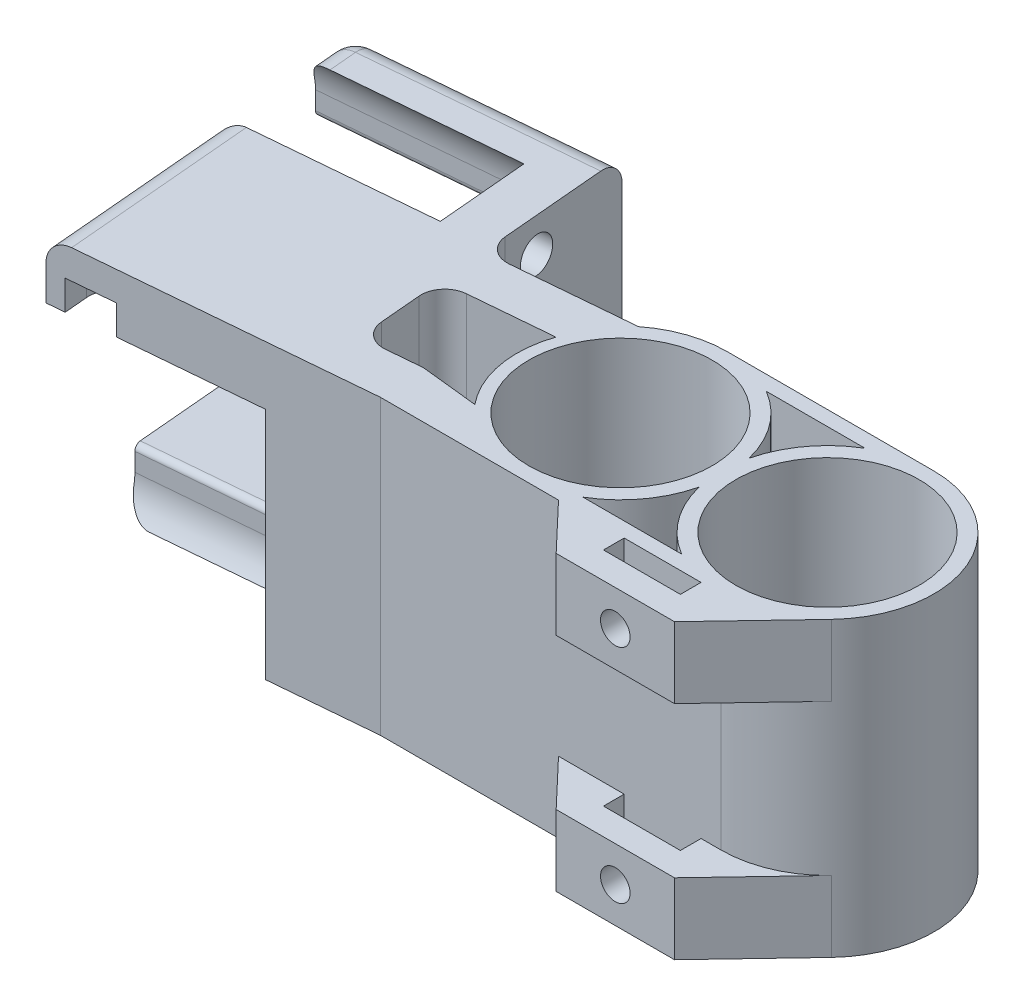
from build123d import *

# Parameters (mm, degrees)
SKETCH1_R               = 7.75
BOSS_EXTRUDE1_DEPTH     = 24
BOSS_EXTRUDE2_START     = 0.75
SKETCH2_R               = 4.33
BOSS_EXTRUDE2_DEPTH     = 0.75
SKETCH4_W               = 10
SKETCH4_H               = 6
BOSS_EXTRUDE4_DEPTH     = 4
CUT_EXTRUDE1_DEPTH      = 35.968736037
CUT_EXTRUDE1_DEPTH_BACK = 35.968736037
SKETCH5_W               = 6.5
SKETCH5_H               = 1.75
SKETCH6_R               = 1.25
CUT_EXTRUDE2_DEPTH      = 16
BOSS_EXTRUDE5_START     = -24.75
BOSS_EXTRUDE5_DEPTH     = 24.75
CUT_EXTRUDE3_DEPTH      = 39.520286863
SKETCH9_W               = 12.886425037
SKETCH9_H               = 24.75
BOSS_EXTRUDE6_DEPTH     = 4
FILLET1_R               = 2
FILLET2_R               = 2
BOSS_EXTRUDE9_DEPTH     = 17.13
SKETCH14_R              = 1.5
CUT_EXTRUDE5_DEPTH      = 6
BOSS_EXTRUDE10_DEPTH    = 14.84
FILLET4_R               = 2
SKETCH16_W              = 4
SKETCH16_H              = 2.5
CUT_EXTRUDE6_DEPTH      = 4
FILLET5_R               = 2
BOSS_EXTRUDE11_DEPTH    = 6
BOSS_EXTRUDE12_START    = -6
BOSS_EXTRUDE12_DEPTH    = 6


with BuildPart() as part:
    # Sketch1 → Boss-Extrude1 (new body)
    with BuildSketch(Plane(origin=(0, 0, 0), x_dir=(1, 0, 0), z_dir=(0, 1, 0))):
        with BuildLine():
            Line((0, -9), (17.5, -9))
            ThreePointArc((17.5, -9), (26.5, 0), (17.5, 9))
            Line((17.5, 9), (0, 9))
            ThreePointArc((0, 9), (-9, 0), (0, -9))
        make_face()
        with Locations(Location((17.5, 0, 0), (0, 0, 270))):
            Circle(SKETCH1_R, mode=Mode.SUBTRACT)
        with BuildLine():
            ThreePointArc((8.75, -2.106537443), (10.26424991, -5.352001554), (12.924248696, -7.75))
            Line((12.924248696, -7.75), (4.575751304, -7.75))
            ThreePointArc((4.575751304, -7.75), (7.23575009, -5.352001554), (8.75, -2.106537443))
        make_face(mode=Mode.SUBTRACT)
        with Locations(Location((0, 0, 0), (0, 0, 270))):
            Circle(SKETCH1_R, mode=Mode.SUBTRACT)
        with BuildLine():
            Line((4.575751304, 7.75), (12.924248696, 7.75))
            ThreePointArc((12.924248696, 7.75), (10.26424991, 5.352001554), (8.75, 2.106537443))
            ThreePointArc((8.75, 2.106537443), (7.23575009, 5.352001554), (4.575751304, 7.75))
        make_face(mode=Mode.SUBTRACT)
    extrude(amount=BOSS_EXTRUDE1_DEPTH)

    # Sketch2 → Boss-Extrude2 (add)
    with BuildSketch(Plane.XZ.offset(BOSS_EXTRUDE2_START)):
        with BuildLine():
            Line((17.5, 9), (0, 9))
            ThreePointArc((0, 9), (-9, 0), (0, -9))
            Line((0, -9), (17.5, -9))
            ThreePointArc((17.5, -9), (26.5, 0), (17.5, 9))
        make_face()
        with Locations(Location((17.5, 0, 0), (0, 0, 270))):
            Circle(SKETCH2_R, mode=Mode.SUBTRACT)
        with Locations(Location((0, 0, 0), (0, 0, 270))):
            Circle(SKETCH2_R, mode=Mode.SUBTRACT)
    extrude(amount=-BOSS_EXTRUDE2_DEPTH)

    # Sketch4 → Boss-Extrude4 (add)
    with BuildSketch(Plane.XY.offset(9)):
        with Locations((12.5625, 2.25)):
            Rectangle(SKETCH4_W, SKETCH4_H)
        with Locations((12.5625, 21)):
            Rectangle(SKETCH4_W, SKETCH4_H)
    extrude(amount=BOSS_EXTRUDE4_DEPTH)

    # Sketch5 → Cut-Extrude1 (cut, two sides: drawn at the far end of the back side and taken through both)
    with BuildSketch(Plane.XZ.offset(-18).offset(-CUT_EXTRUDE1_DEPTH_BACK)):
        with Locations((12.5625, 9.875)):
            Rectangle(SKETCH5_W, SKETCH5_H)
    extrude(amount=CUT_EXTRUDE1_DEPTH + CUT_EXTRUDE1_DEPTH_BACK, mode=Mode.SUBTRACT)

    # Sketch6 → Cut-Extrude2 (cut)
    with BuildSketch(Plane.XY.offset(13)):
        with Locations((12.5625, 2.25)):
            Circle(SKETCH6_R)
        with Locations((12.5625, 21)):
            Circle(SKETCH6_R)
    extrude(amount=-CUT_EXTRUDE2_DEPTH, mode=Mode.SUBTRACT)

    # Sketch7 → Boss-Extrude5 (add)
    with BuildSketch(Plane(origin=(0, 24, 0), x_dir=(1, 0, 0), z_dir=(0, 1, 0)).offset(BOSS_EXTRUDE5_START)):
        with BuildLine():
            Line((-20.224515403, -9.780709308), (-11.300967177, -9))
            Line((-11.300967177, -9), (0, -9))
            ThreePointArc((0, -9), (-8.505937794, -2.940922006), (-5.558955476, 7.077995056))
            Line((-5.558955476, 7.077995056), (-21.576855644, 5.676610378))
            Line((-21.576855644, 5.676610378), (-20.224515403, -9.780709308))
        make_face()
    extrude(amount=BOSS_EXTRUDE5_DEPTH)

    # Sketch8 → Cut-Extrude3 (cut, through all)
    with BuildSketch(Plane(origin=(0, 24, 0), x_dir=(1, 0, 0), z_dir=(0, 1, 0))):
        with BuildLine():
            Line((-16.588359581, -5.447307545), (-11.649590148, -5.015221208))
            Line((-11.649590148, -5.015221208), (-6.776158873, -5.535898385))
            ThreePointArc((-6.776158873, -5.535898385), (-8.611505528, -1.550636174), (-8.281582293, 2.824516725))
            Line((-8.281582293, 2.824516725), (-17.24345388, 2.040454557))
            Line((-17.24345388, 2.040454557), (-16.588359581, -5.447307545))
        make_face()
    extrude(amount=-CUT_EXTRUDE3_DEPTH, mode=Mode.SUBTRACT)

    # Sketch9 → Boss-Extrude6 (add)
    with BuildSketch(Plane(origin=(-20.92008866, 0, 1.830270598), x_dir=(0.08715574274765853, 0, 0.9961946980917455), z_dir=(-0.9961946980917455, 0, 0.08715574274765853))):
        with Locations((-13.978768561, 11.625)):
            Rectangle(SKETCH9_W, SKETCH9_H)
    extrude(amount=-BOSS_EXTRUDE6_DEPTH)

    # Fillet1
    fillet1_edges = [part.edges().sort_by_distance(p)[0] for p in [
        (-16.588359581, 11.625, 5.447307545),
        (-17.24345388, 11.625, -2.040454557),
        (-17.592076851, 11.625, -6.025233349),
    ]]
    fillet(fillet1_edges, radius=FILLET1_R)

    # Fillet2
    fillet2_edges = [part.edges().sort_by_distance(p)[0] for p in [
        (-20.707592193, -0.75, -18.688310163),
        (-20.707592193, 24, -18.688310163),
    ]]
    fillet(fillet2_edges, radius=FILLET2_R)

    # Sketch13 → Boss-Extrude9 (add)
    with BuildSketch(Plane(origin=(-20.92008866, 0, 1.830270598), x_dir=(0.08715574274765853, 0, 0.9961946980917455), z_dir=(-0.9961946980917455, 0, 0.08715574274765853))):
        with BuildLine():
            Line((-7.231981079, 21.08), (-7.231981079, 19.545))
            ThreePointArc((-7.231981079, 19.545), (-7.085534469, 19.191446609), (-6.731981079, 19.045))
            Line((-6.731981079, 19.045), (7.980808095, 19.045))
            Line((7.980808095, 19.045), (7.980808095, 24))
            Line((7.980808095, 24), (-8.270307829, 24))
            ThreePointArc((-8.270307829, 24), (-7.499287378, 22.629558198), (-7.231981079, 21.08))
        make_face()
        with BuildLine():
            Line((-20.421981079, 19.045), (-17.581981079, 19.045))
            ThreePointArc((-17.581981079, 19.045), (-17.228427688, 19.191446609), (-17.081981079, 19.545))
            Line((-17.081981079, 19.545), (-17.081981079, 21.08))
            ThreePointArc((-17.081981079, 21.08), (-16.814674779, 22.629558198), (-16.043654328, 24))
            Line((-16.043654328, 24), (-18.421981079, 24))
            ThreePointArc((-18.421981079, 24), (-19.836194641, 23.414213562), (-20.421981079, 22))
            Line((-20.421981079, 22), (-20.421981079, 19.045))
        make_face()
        with BuildLine():
            ThreePointArc((-0.281981079, 3.705), (-0.428427688, 4.058553391), (-0.781981079, 4.205))
            Line((-0.781981079, 4.205), (-20.421981079, 4.205))
            Line((-20.421981079, 4.205), (-20.421981079, 1.25))
            ThreePointArc((-20.421981079, 1.25), (-19.836194641, -0.164213562), (-18.421981079, -0.75))
            Line((-18.421981079, -0.75), (0.756345672, -0.75))
            ThreePointArc((0.756345672, -0.75), (-0.014674779, 0.620441802), (-0.281981079, 2.17))
            Line((-0.281981079, 2.17), (-0.281981079, 3.705))
        make_face()
    extrude(amount=BOSS_EXTRUDE9_DEPTH)

    # Sketch14 → Cut-Extrude5 (cut)
    with BuildSketch(Plane(origin=(-20.92008866, 0, 1.830270598), x_dir=(0.08715574274765853, 0, 0.9961946980917455), z_dir=(-0.9961946980917455, 0, 0.08715574274765853))):
        with Locations((-12.456981079, 21.08)):
            Circle(SKETCH14_R)
        with Locations((4.943018921, 2.17)):
            Circle(SKETCH14_R)
    extrude(amount=-CUT_EXTRUDE5_DEPTH, mode=Mode.SUBTRACT)

    # Sketch15 → Boss-Extrude10 (add)
    with BuildSketch(Plane.XZ.offset(-19.045)):
        with BuildLine():
            ThreePointArc((-22.605549661, -17.434636803), (-23.103926759, -18.03259557), (-23.779343463, -18.419566749))
            Line((-23.779343463, -18.419566749), (-22.699981589, -18.513998677))
            Line((-22.699981589, -18.513998677), (-22.605549661, -17.434636803))
        make_face()
    extrude(amount=BOSS_EXTRUDE10_DEPTH)

    # Fillet4
    fillet4_edges = [part.edges().sort_by_distance(p)[0] for p in [
        (-37.99751962, 24, 3.179049421),
        (-38.754734626, -0.75, -5.475957694),
        (-39.713742115, -0.164213562, -16.437463461),
        (-39.764796768, 2.7275, -17.021020804),
        (-39.764796768, 20.5225, -17.021020804),
        (-39.713742115, 23.414213562, -16.437463461),
        (-39.486842865, 24, -13.843993158),
    ]]
    fillet(fillet4_edges, radius=FILLET4_R)

    # Sketch16 → Cut-Extrude6 (cut)
    with BuildSketch(Plane(origin=(0.695573257, 0, 7.95043871), x_dir=(0.9961946980917455, 0, -0.08715574274765835), z_dir=(0.08715574274765836, 0, 0.9961946980917457))):
        with Locations((-34.63, 20.295)):
            Rectangle(SKETCH16_W, SKETCH16_H)
    extrude(amount=-CUT_EXTRUDE6_DEPTH, mode=Mode.SUBTRACT)

    # Fillet5
    fillet5_edges = [part.edges().sort_by_distance(p)[0] for p in [
        (-36.143661505, 20.295, 7.158174775),
        (-34.151272109, 21.545, 6.983863289),
    ]]
    fillet(fillet5_edges, radius=FILLET5_R)

    # Sketch17 → Boss-Extrude11 (add)
    with BuildSketch(Plane.XZ.offset(0.75)):
        Polygon((7.5625, 9), (7.5625, 13), (3.76173375, 9), align=None)
        with BuildLine():
            Line((24.024370778, 6.199402064), (17.5625, 13))
            Line((17.5625, 13), (17.5625, 9))
            Line((17.5625, 9), (17.5, 9))
            ThreePointArc((17.5, 9), (21.050026861, 8.270266579), (24.024370778, 6.199402064))
        make_face()
    extrude(amount=-BOSS_EXTRUDE11_DEPTH)

    # Sketch18 → Boss-Extrude12 (add)
    with BuildSketch(Plane(origin=(0, 24, 0), x_dir=(1, 0, 0), z_dir=(0, 1, 0)).offset(BOSS_EXTRUDE12_START)):
        with BuildLine():
            ThreePointArc((24.024370778, -6.199402064), (21.050026861, -8.270266579), (17.5, -9))
            Line((17.5, -9), (17.5625, -9))
            Line((17.5625, -9), (17.5625, -13))
            Line((17.5625, -13), (24.024370778, -6.199402064))
        make_face()
        Polygon((7.5625, -13), (7.5625, -9), (3.76173375, -9), align=None)
    extrude(amount=BOSS_EXTRUDE12_DEPTH)


solid = part.part
